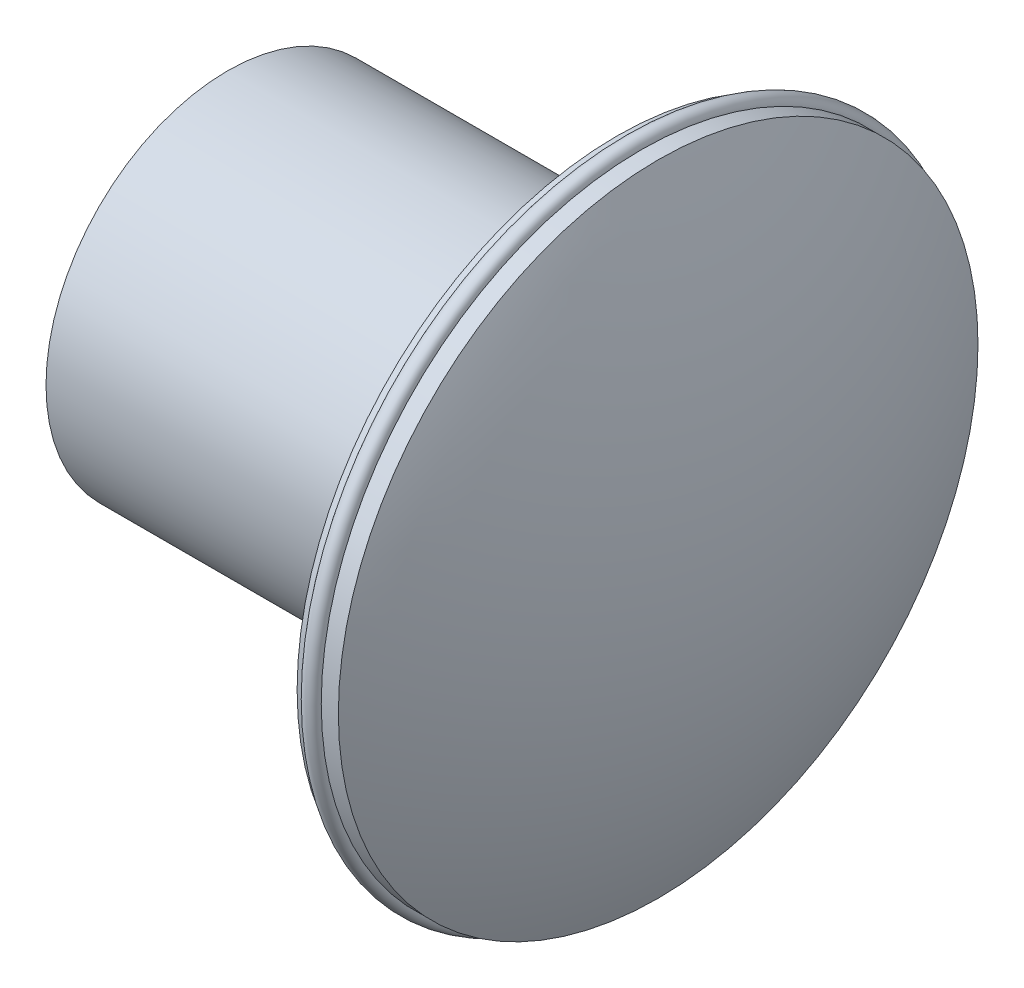
from build123d import *


with BuildPart() as part:
    # Sketch1 → Revolve4 (revolve)
    with BuildSketch(Plane.XY, mode=Mode.PRIVATE) as revolve4_sk:
        with BuildLine():
            Line((38.1, 0), (38.1, 28.297740308))
            Line((38.1, 28.297740308), (36.585463954, 28.297740308))
            ThreePointArc((36.585463954, 28.297740308), (35.85204428, 29.031159981), (35.118624607, 28.297740308))
            Line((35.118624607, 28.297740308), (34.45126123, 28.297740308))
            Line((34.45126123, 28.297740308), (26.83126123, 16.064574588))
            Line((26.83126123, 16.064574588), (0, 16.064574588))
            Line((0, 16.064574588), (0, 0))
            Line((0, 0), (38.1, 0))
        make_face()
    revolve(revolve4_sk.sketch.rotate(Axis((-76.840094259, 0, 0), (1, 0, 0)), 90), axis=Axis((-76.840094259, 0, 0), (1, 0, 0)))

    # Sketch11 → Revolve7 (revolve)
    with BuildSketch(Plane.XY):
        with BuildLine():
            Line((38.1, 28.297740308), (38.1, 0))
            Line((38.1, 0), (44.45, 0))
            ThreePointArc((44.45, 0), (42.843003167, 14.500729348), (38.1, 28.297740308))
        make_face()
    revolve(axis=Axis((38.1, 0, 0), (1, 0, 0)))


solid = part.part
